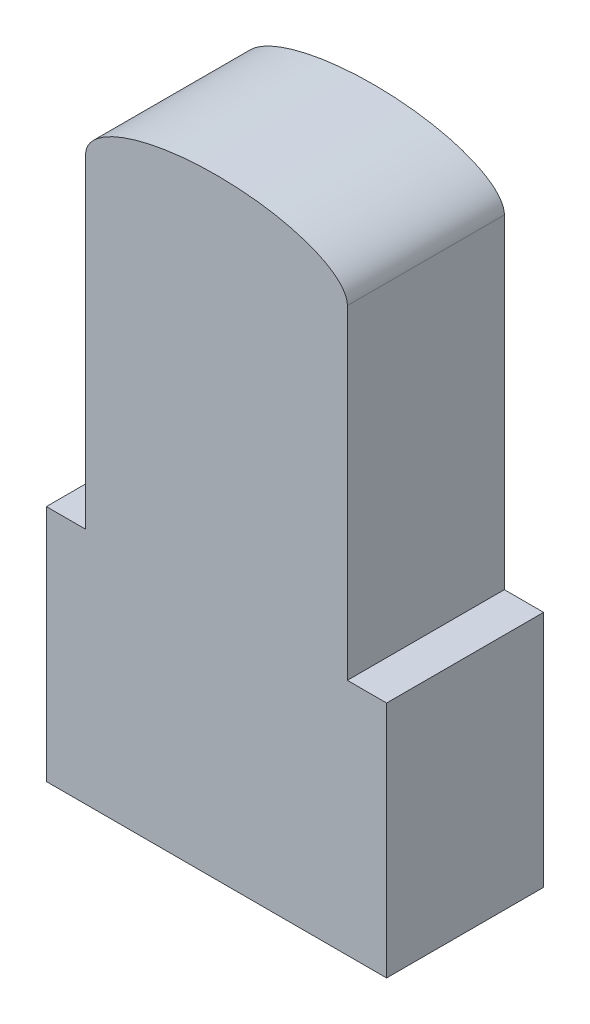
from build123d import *

# Parameters (mm, degrees)
SALIENTE_EXTRUIR1_DEPTH = 3


with BuildPart() as part:
    # Model → Saliente-Extruir1 (new body)
    with BuildSketch(Plane.XY):
        with BuildLine():
            Line((10.797323325, 296.517948625), (10.797323325, 290.317948625))
            Line((10.797323325, 290.317948625), (10.047323325, 290.317948625))
            Line((10.047323325, 290.317948625), (10.047323325, 285.767948625))
            Line((10.047323325, 285.767948625), (16.547323325, 285.767948625))
            Line((16.547323325, 285.767948625), (16.547323325, 290.317948625))
            Line((16.547323325, 290.317948625), (15.797323325, 290.317948625))
            Line((15.797323325, 290.317948625), (15.797323325, 296.517948625))
            add(Edge.make_bspline(
                [(15.797323325, 296.517948625), (15.797323325, 297.427435834), (13.297323325, 297.427435834), (10.797323325, 297.427435834), (10.797323325, 296.517948625)],
                knots=[0, 0, 0, 1.570796327, 1.570796327, 3.141592654, 3.141592654, 3.141592654], degree=2, weights=[1, 0.707106781, 1, 0.707106781, 1]))
        make_face()
    extrude(amount=SALIENTE_EXTRUIR1_DEPTH)


solid = part.part
